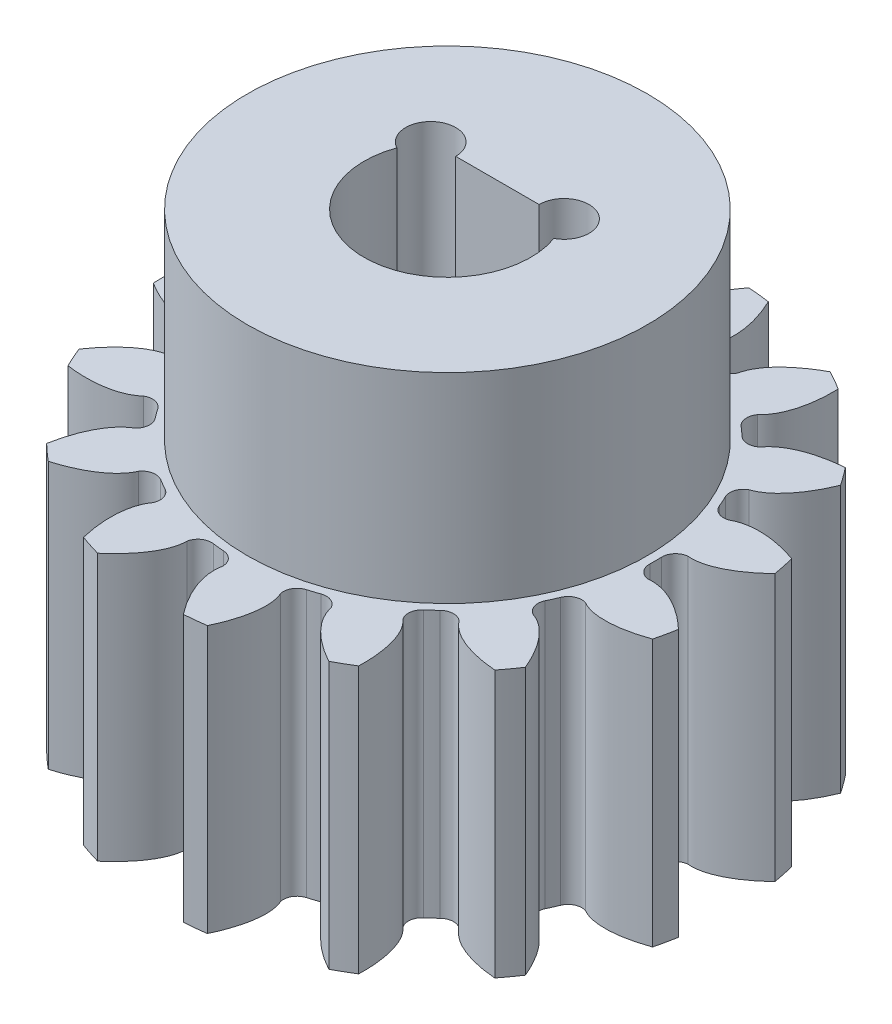
from build123d import *

# Parameters (mm, degrees)
BOSS_EXTRUDE1_DEPTH = 8
SKETCH3_R           = 6
BOSS_EXTRUDE2_DEPTH = 6
CUT_EXTRUDE1_DEPTH  = 19.444093641
SKETCH5_R           = 0.75
CUT_EXTRUDE2_DEPTH  = 19.444093641


with BuildPart() as part:
    # Sketch1 → Boss-Extrude1 (new body)
    with BuildSketch(Plane.XZ.offset(8)):
        with BuildLine():
            ThreePointArc((-0.827882234, 6.194926231), (-1.121313534, 6.268142089), (-1.28490087, 6.522507325))
            add(Edge.make_bspline(
                [(-1.28490087, 6.522507325), (-1.283143894, 7.307435027), (-2.312733921, 8.179319153)],
                knots=[3.422859988, 3.422859988, 3.422859988, 4.367994566, 4.367994566, 4.367994566], degree=2, weights=[1, 0.890402661, 1]))
            ThreePointArc((-2.312733921, 8.179319153), (-2.626644452, 8.083980389), (-2.936642127, 7.976599088))
            add(Edge.make_bspline(
                [(-2.936642127, 7.976599088), (-3.257117324, 6.666052179), (-2.794326973, 6.032065054)],
                knots=[1.915190741, 1.915190741, 1.915190741, 2.860325319, 2.860325319, 2.860325319], degree=2, weights=[1, 0.890402661, 1]))
            ThreePointArc((-2.794326973, 6.032065054), (-2.777159774, 5.730125032), (-2.971515481, 5.498417567))
            ThreePointArc((-2.971515481, 5.498417567), (-3.125, 5.412658774), (-3.276011553, 5.322616678))
            ThreePointArc((-3.276011553, 5.322616678), (-3.573853957, 5.27015343), (-3.826758088, 5.435990673))
            add(Edge.make_bspline(
                [(-3.826758088, 5.435990673), (-4.144411868, 6.153772436), (-5.439616383, 6.531506228)],
                knots=[3.422859988, 3.422859988, 3.422859988, 4.367994566, 4.367994566, 4.367994566], degree=2, weights=[1, 0.890402661, 1]))
            ThreePointArc((-5.439616383, 6.531506228), (-5.687610154, 6.316731017), (-5.927131212, 6.092545904))
            add(Edge.make_bspline(
                [(-5.927131212, 6.092545904), (-5.686852423, 4.764952722), (-5.006206605, 4.374010458)],
                knots=[1.915190741, 1.915190741, 1.915190741, 2.860325319, 2.860325319, 2.860325319], degree=2, weights=[1, 0.890402661, 1]))
            ThreePointArc((-5.006206605, 4.374010458), (-4.867713516, 4.105157051), (-4.951022374, 3.814430161))
            ThreePointArc((-4.951022374, 3.814430161), (-5.056356215, 3.673657827), (-5.157688714, 3.529978347))
            ThreePointArc((-5.157688714, 3.529978347), (-5.408442564, 3.360907366), (-5.706934066, 3.409541848))
            add(Edge.make_bspline(
                [(-5.706934066, 3.409541848), (-6.28907338, 3.936066685), (-7.625939755, 3.754336539)],
                knots=[0.281267335, 0.281267335, 0.281267335, 1.226401912, 1.226401912, 1.226401912], degree=2, weights=[1, 0.890402661, 1]))
            ThreePointArc((-7.625939755, 3.754336539), (-7.76513639, 3.457261466), (-7.892765465, 3.155036184))
            add(Edge.make_bspline(
                [(-7.892765465, 3.155036184), (-7.133279074, 2.039949651), (-6.352467634, 1.959649716)],
                knots=[1.915190741, 1.915190741, 1.915190741, 2.860325319, 2.860325319, 2.860325319], degree=2, weights=[1, 0.890402661, 1]))
            ThreePointArc((-6.352467634, 1.959649716), (-6.11659537, 1.770370122), (-6.074452519, 1.470893127))
            ThreePointArc((-6.074452519, 1.470893127), (-6.113422505, 1.299448068), (-6.147554639, 1.126974691))
            ThreePointArc((-6.147554639, 1.126974691), (-6.307862317, 0.870529885), (-6.600329299, 0.793552264))
            add(Edge.make_bspline(
                [(-6.600329299, 0.793552264), (-7.346296969, 1.037779247), (-8.493668865, 0.328007955)],
                knots=[0.281267335, 0.281267335, 0.281267335, 1.226401912, 1.226401912, 1.226401912], degree=2, weights=[1, 0.890402661, 1]))
            ThreePointArc((-8.493668865, 0.328007955), (-8.5, 0), (-8.493668865, -0.328007955))
            add(Edge.make_bspline(
                [(-8.493668865, -0.328007955), (-7.346296969, -1.037779247), (-6.600329299, -0.793552264)],
                knots=[1.915190741, 1.915190741, 1.915190741, 2.860325319, 2.860325319, 2.860325319], degree=2, weights=[1, 0.890402661, 1]))
            ThreePointArc((-6.600329299, -0.793552264), (-6.307862317, -0.870529885), (-6.147554639, -1.126974691))
            ThreePointArc((-6.147554639, -1.126974691), (-6.113422505, -1.299448068), (-6.074452519, -1.470893127))
            ThreePointArc((-6.074452519, -1.470893127), (-6.11659537, -1.770370122), (-6.352467634, -1.959649716))
            add(Edge.make_bspline(
                [(-6.352467634, -1.959649716), (-7.133279074, -2.039949651), (-7.892765465, -3.155036184)],
                knots=[3.422859988, 3.422859988, 3.422859988, 4.367994566, 4.367994566, 4.367994566], degree=2, weights=[1, 0.890402661, 1]))
            ThreePointArc((-7.892765465, -3.155036184), (-7.76513639, -3.457261466), (-7.625939755, -3.754336539))
            add(Edge.make_bspline(
                [(-7.625939755, -3.754336539), (-6.28907338, -3.936066685), (-5.706934066, -3.409541848)],
                knots=[1.915190741, 1.915190741, 1.915190741, 2.860325319, 2.860325319, 2.860325319], degree=2, weights=[1, 0.890402661, 1]))
            ThreePointArc((-5.706934066, -3.409541848), (-5.408442564, -3.360907366), (-5.157688714, -3.529978347))
            ThreePointArc((-5.157688714, -3.529978347), (-5.056356215, -3.673657827), (-4.951022374, -3.814430161))
            ThreePointArc((-4.951022374, -3.814430161), (-4.867713516, -4.105157051), (-5.006206605, -4.374010458))
            add(Edge.make_bspline(
                [(-5.006206605, -4.374010458), (-5.686852423, -4.764952722), (-5.927131212, -6.092545904)],
                knots=[3.422859988, 3.422859988, 3.422859988, 4.367994566, 4.367994566, 4.367994566], degree=2, weights=[1, 0.890402661, 1]))
            ThreePointArc((-5.927131212, -6.092545904), (-5.687610154, -6.316731017), (-5.439616383, -6.531506228))
            add(Edge.make_bspline(
                [(-5.439616383, -6.531506228), (-4.144411868, -6.153772436), (-3.826758088, -5.435990673)],
                knots=[1.915190741, 1.915190741, 1.915190741, 2.860325319, 2.860325319, 2.860325319], degree=2, weights=[1, 0.890402661, 1]))
            ThreePointArc((-3.826758088, -5.435990673), (-3.573853957, -5.27015343), (-3.276011553, -5.322616678))
            ThreePointArc((-3.276011553, -5.322616678), (-3.125, -5.412658774), (-2.971515481, -5.498417567))
            ThreePointArc((-2.971515481, -5.498417567), (-2.777159774, -5.730125032), (-2.794326973, -6.032065054))
            add(Edge.make_bspline(
                [(-2.794326973, -6.032065054), (-3.257117324, -6.666052179), (-2.936642127, -7.976599088)],
                knots=[0.281267335, 0.281267335, 0.281267335, 1.226401912, 1.226401912, 1.226401912], degree=2, weights=[1, 0.890402661, 1]))
            ThreePointArc((-2.936642127, -7.976599088), (-2.626644452, -8.083980389), (-2.312733921, -8.179319153))
            add(Edge.make_bspline(
                [(-2.312733921, -8.179319153), (-1.283143894, -7.307435027), (-1.28490087, -6.522507325)],
                knots=[5.056783395, 5.056783395, 5.056783395, 6.001917973, 6.001917973, 6.001917973], degree=2, weights=[1, 0.890402661, 1]))
            ThreePointArc((-1.28490087, -6.522507325), (-1.121313534, -6.268142089), (-0.827882234, -6.194926231))
            ThreePointArc((-0.827882234, -6.194926231), (-0.653302895, -6.215761846), (-0.478206567, -6.231678625))
            ThreePointArc((-0.478206567, -6.231678625), (-0.206409877, -6.364302338), (-0.099282823, -6.647120803))
            add(Edge.make_bspline(
                [(-0.099282823, -6.647120803), (-0.264197051, -7.414530656), (0.561619061, -8.481425825)],
                knots=[3.422859988, 3.422859988, 3.422859988, 4.367994566, 4.367994566, 4.367994566], degree=2, weights=[1, 0.890402661, 1]))
            ThreePointArc((0.561619061, -8.481425825), (0.888491938, -8.453436111), (1.214041247, -8.41285349))
            add(Edge.make_bspline(
                [(1.214041247, -8.41285349), (1.799991316, -7.197575716), (1.47912738, -6.481223206)],
                knots=[5.056783395, 5.056783395, 5.056783395, 6.001917973, 6.001917973, 6.001917973], degree=2, weights=[1, 0.890402661, 1]))
            ThreePointArc((1.47912738, -6.481223206), (1.525112186, -6.182312036), (1.763395445, -5.996076759))
            ThreePointArc((1.763395445, -5.996076759), (1.931356215, -5.944103227), (2.097788608, -5.887425835))
            ThreePointArc((2.097788608, -5.887425835), (2.400030163, -5.898033952), (2.61292823, -6.112828978))
            add(Edge.make_bspline(
                [(2.61292823, -6.112828978), (2.774405293, -6.880969422), (3.96277121, -7.519736986)],
                knots=[3.422859988, 3.422859988, 3.422859988, 4.367994566, 4.367994566, 4.367994566], degree=2, weights=[1, 0.890402661, 1]))
            ThreePointArc((3.96277121, -7.519736986), (4.25, -7.361215932), (4.530897654, -7.19172903))
            add(Edge.make_bspline(
                [(4.530897654, -7.19172903), (4.571891676, -5.843190176), (3.987401069, -5.319276715)],
                knots=[5.056783395, 5.056783395, 5.056783395, 6.001917973, 6.001917973, 6.001917973], degree=2, weights=[1, 0.890402661, 1]))
            ThreePointArc((3.987401069, -5.319276715), (3.907832153, -5.027504067), (4.049766032, -4.760451143))
            ThreePointArc((4.049766032, -4.760451143), (4.18206629, -4.644655159), (4.311057074, -4.525183632))
            ThreePointArc((4.311057074, -4.525183632), (4.591483184, -4.411941914), (4.873340254, -4.52157349))
            add(Edge.make_bspline(
                [(4.873340254, -4.52157349), (5.333287757, -5.157626065), (6.678724217, -5.257817307)],
                knots=[3.422859988, 3.422859988, 3.422859988, 4.367994566, 4.367994566, 4.367994566], degree=2, weights=[1, 0.890402661, 1]))
            ThreePointArc((6.678724217, -5.257817307), (6.876644452, -4.996174644), (7.064320695, -4.727089286))
            add(Edge.make_bspline(
                [(7.064320695, -4.727089286), (6.55327043, -3.47846397), (5.806216889, -3.237578955)],
                knots=[5.056783395, 5.056783395, 5.056783395, 6.001917973, 6.001917973, 6.001917973], degree=2, weights=[1, 0.890402661, 1]))
            ThreePointArc((5.806216889, -3.237578955), (5.61485244, -3.003394972), (5.63589528, -2.701700277))
            ThreePointArc((5.63589528, -2.701700277), (5.70965911, -2.542104019), (5.778904607, -2.38049607))
            ThreePointArc((5.778904607, -2.38049607), (5.98902705, -2.162985038), (6.291107475, -2.148496867))
            add(Edge.make_bspline(
                [(6.291107475, -2.148496867), (6.969996317, -2.542482305), (8.239865133, -2.086773249)],
                knots=[3.422859988, 3.422859988, 3.422859988, 4.367994566, 4.367994566, 4.367994566], degree=2, weights=[1, 0.890402661, 1]))
            ThreePointArc((8.239865133, -2.086773249), (8.314254606, -1.767249372), (8.37625851, -1.44509286))
            add(Edge.make_bspline(
                [(8.37625851, -1.44509286), (7.401529193, -0.512279744), (6.621085061, -0.596074382)],
                knots=[5.056783395, 5.056783395, 5.056783395, 6.001917973, 6.001917973, 6.001917973], degree=2, weights=[1, 0.890402661, 1]))
            ThreePointArc((6.621085061, -0.596074382), (6.351013731, -0.459971601), (6.247527035, -0.175800889))
            ThreePointArc((6.247527035, -0.175800889), (6.25, 0), (6.247527035, 0.175800889))
            ThreePointArc((6.247527035, 0.175800889), (6.351013731, 0.459971601), (6.621085061, 0.596074382))
            add(Edge.make_bspline(
                [(6.621085061, 0.596074382), (7.401529193, 0.512279744), (8.37625851, 1.44509286)],
                knots=[0.281267335, 0.281267335, 0.281267335, 1.226401912, 1.226401912, 1.226401912], degree=2, weights=[1, 0.890402661, 1]))
            ThreePointArc((8.37625851, 1.44509286), (8.314254606, 1.767249372), (8.239865133, 2.086773249))
            add(Edge.make_bspline(
                [(8.239865133, 2.086773249), (6.969996317, 2.542482305), (6.291107475, 2.148496867)],
                knots=[1.915190741, 1.915190741, 1.915190741, 2.860325319, 2.860325319, 2.860325319], degree=2, weights=[1, 0.890402661, 1]))
            ThreePointArc((6.291107475, 2.148496867), (5.98902705, 2.162985038), (5.778904607, 2.38049607))
            ThreePointArc((5.778904607, 2.38049607), (5.70965911, 2.542104019), (5.63589528, 2.701700277))
            ThreePointArc((5.63589528, 2.701700277), (5.61485244, 3.003394972), (5.806216889, 3.237578955))
            add(Edge.make_bspline(
                [(5.806216889, 3.237578955), (6.55327043, 3.47846397), (7.064320695, 4.727089286)],
                knots=[3.422859988, 3.422859988, 3.422859988, 4.367994566, 4.367994566, 4.367994566], degree=2, weights=[1, 0.890402661, 1]))
            ThreePointArc((7.064320695, 4.727089286), (6.876644452, 4.996174644), (6.678724217, 5.257817307))
            add(Edge.make_bspline(
                [(6.678724217, 5.257817307), (5.333287757, 5.157626065), (4.873340254, 4.52157349)],
                knots=[1.915190741, 1.915190741, 1.915190741, 2.860325319, 2.860325319, 2.860325319], degree=2, weights=[1, 0.890402661, 1]))
            ThreePointArc((4.873340254, 4.52157349), (4.591483184, 4.411941914), (4.311057074, 4.525183632))
            ThreePointArc((4.311057074, 4.525183632), (4.18206629, 4.644655159), (4.049766032, 4.760451143))
            ThreePointArc((4.049766032, 4.760451143), (3.907832153, 5.027504067), (3.987401069, 5.319276715))
            add(Edge.make_bspline(
                [(3.987401069, 5.319276715), (4.571891676, 5.843190176), (4.530897654, 7.19172903)],
                knots=[0.281267335, 0.281267335, 0.281267335, 1.226401912, 1.226401912, 1.226401912], degree=2, weights=[1, 0.890402661, 1]))
            ThreePointArc((4.530897654, 7.19172903), (4.25, 7.361215932), (3.96277121, 7.519736986))
            add(Edge.make_bspline(
                [(3.96277121, 7.519736986), (2.774405293, 6.880969422), (2.61292823, 6.112828978)],
                knots=[1.915190741, 1.915190741, 1.915190741, 2.860325319, 2.860325319, 2.860325319], degree=2, weights=[1, 0.890402661, 1]))
            ThreePointArc((2.61292823, 6.112828978), (2.400030163, 5.898033952), (2.097788608, 5.887425835))
            ThreePointArc((2.097788608, 5.887425835), (1.931356215, 5.944103227), (1.763395445, 5.996076759))
            ThreePointArc((1.763395445, 5.996076759), (1.525112186, 6.182312036), (1.47912738, 6.481223206))
            add(Edge.make_bspline(
                [(1.47912738, 6.481223206), (1.799991316, 7.197575716), (1.214041247, 8.41285349)],
                knots=[0.281267335, 0.281267335, 0.281267335, 1.226401912, 1.226401912, 1.226401912], degree=2, weights=[1, 0.890402661, 1]))
            ThreePointArc((1.214041247, 8.41285349), (0.888491938, 8.453436111), (0.561619061, 8.481425825))
            add(Edge.make_bspline(
                [(0.561619061, 8.481425825), (-0.264197051, 7.414530656), (-0.099282823, 6.647120803)],
                knots=[1.915190741, 1.915190741, 1.915190741, 2.860325319, 2.860325319, 2.860325319], degree=2, weights=[1, 0.890402661, 1]))
            ThreePointArc((-0.099282823, 6.647120803), (-0.206409877, 6.364302338), (-0.478206567, 6.231678625))
            ThreePointArc((-0.478206567, 6.231678625), (-0.653302895, 6.215761846), (-0.827882234, 6.194926231))
        make_face()
    extrude(amount=-BOSS_EXTRUDE1_DEPTH)

    # Sketch3 → Boss-Extrude2 (add)
    with BuildSketch(Plane(origin=(0, 0, 0), x_dir=(1, 0, 0), z_dir=(0, 1, 0))):
        with Locations(Location((0, 0, 0), (0, 0, 90))):
            Circle(SKETCH3_R)
    extrude(amount=BOSS_EXTRUDE2_DEPTH)

    # Sketch4 → Cut-Extrude1 (cut, through all)
    with BuildSketch(Plane(origin=(0, 6, 0), x_dir=(1, 0, 0), z_dir=(0, 1, 0))):
        with BuildLine():
            Line((-2, 1.5), (2, 1.5))
            ThreePointArc((2, 1.5), (0, -2.5), (-2, 1.5))
        make_face()
    extrude(amount=-CUT_EXTRUDE1_DEPTH, mode=Mode.SUBTRACT)

    # Sketch5 → Cut-Extrude2 (cut, through all)
    with BuildSketch(Plane(origin=(0, 6, 0), x_dir=(1, 0, 0), z_dir=(0, 1, 0))):
        with Locations((-2, 1.5)):
            Circle(SKETCH5_R)
        with Locations((2, 1.5)):
            Circle(SKETCH5_R)
    extrude(amount=-CUT_EXTRUDE2_DEPTH, mode=Mode.SUBTRACT)


solid = part.part
